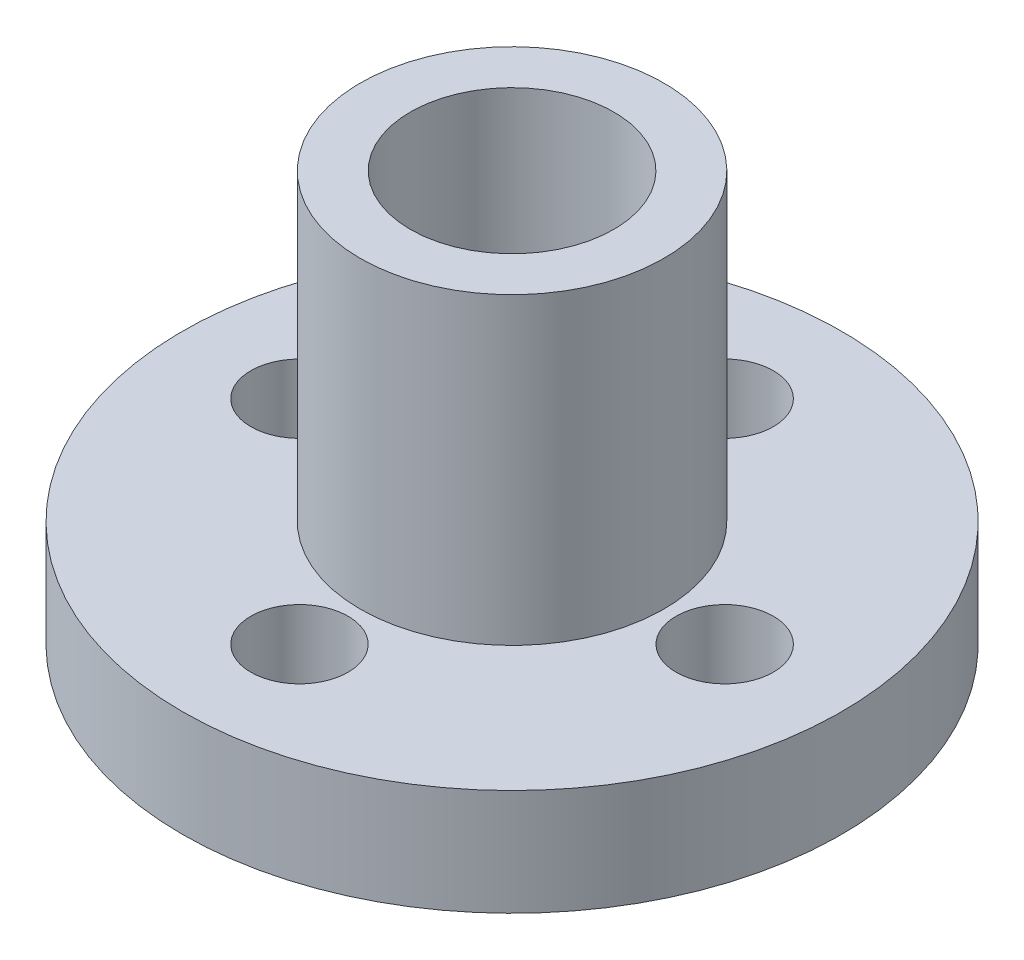
from build123d import *

# Parameters (mm, degrees)
SKETCH_1_R          = 10.85
SKETCH_1_R_2        = 3.4
EXTRUDE_1_DEPTH     = 3.5
SKETCH_2_R          = 5
SKETCH_2_R_2        = 3.35
EXTRUDE_2_DEPTH     = 10
SKETCH_3_R          = 1.6
CUT_EXTRUDE_1_DEPTH = 19.315157657
EXTRUDE_START       = 1.5
SKETCH_4_R          = 5
SKETCH_4_R_2        = 3.35
EXTRUDE_3_DEPTH     = 1.5


with BuildPart() as part:
    # Эскиз1 → Бобышка-Вытянуть1 (new body)
    with BuildSketch(Plane(origin=(0, 0, 0), x_dir=(1, 0, 0), z_dir=(0, 1, 0))):
        with Locations(Location((0, 0, 0), (0, 0, 270))):
            Circle(SKETCH_1_R)
        with Locations(Location((0, 0, 0), (0, 0, 270))):
            Circle(SKETCH_1_R_2, mode=Mode.SUBTRACT)
    extrude(amount=EXTRUDE_1_DEPTH)

    # Эскиз2 → Бобышка-Вытянуть2 (add)
    with BuildSketch(Plane(origin=(0, 3.5, 0), x_dir=(1, 0, 0), z_dir=(0, 1, 0))):
        with Locations(Location((0, 0, 0), (0, 0, 270))):
            Circle(SKETCH_2_R)
        with Locations(Location((0, 0, 0), (0, 0, 270))):
            Circle(SKETCH_2_R_2, mode=Mode.SUBTRACT)
    extrude(amount=EXTRUDE_2_DEPTH)

    # Эскиз3 → Вырез-Вытянуть1 (cut, through all)
    with BuildSketch(Plane(origin=(0, 3.5, 0), x_dir=(1, 0, 0), z_dir=(0, 1, 0))):
        with Locations(Location((0, 7, 0), (0, 0, 270))):
            Circle(SKETCH_3_R)
        with Locations(Location((-7, 0, 0), (0, 0, 270))):
            Circle(SKETCH_3_R)
        with Locations(Location((0, -7, 0), (0, 0, 270))):
            Circle(SKETCH_3_R)
        with Locations(Location((7, 0, 0), (0, 0, 270))):
            Circle(SKETCH_3_R)
    extrude(amount=-CUT_EXTRUDE_1_DEPTH, mode=Mode.SUBTRACT)

    # Эскиз4 → Бобышка-Вытянуть3 (add)
    with BuildSketch(Plane(origin=(0, 0, 0), x_dir=(-1, 0, 0), z_dir=(0, -1, 0)).offset(EXTRUDE_START)):
        with Locations(Location((0, 0, 0), (0, 0, 270))):
            Circle(SKETCH_4_R)
        with Locations(Location((0, 0, 0), (0, 0, 270))):
            Circle(SKETCH_4_R_2, mode=Mode.SUBTRACT)
    extrude(amount=-EXTRUDE_3_DEPTH)


solid = part.part
